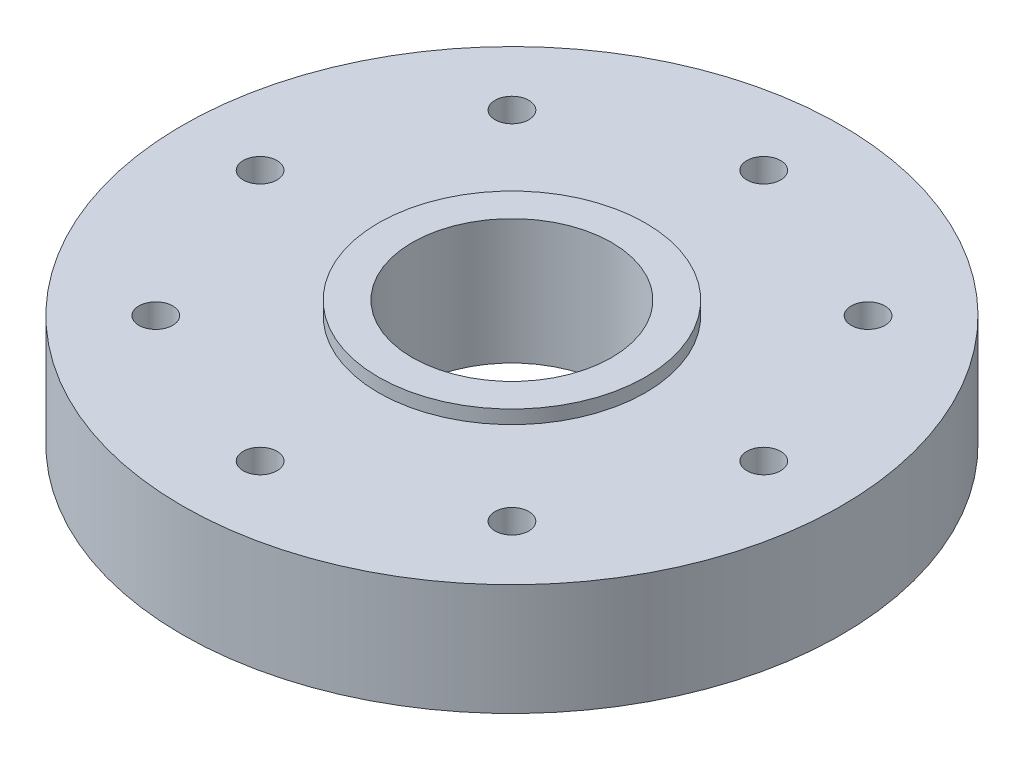
from build123d import *

# Parameters (mm, degrees)
SKETCH1_R           = 9.75
SKETCH1_R_2         = 2.95
SKETCH1_R_3         = 0.5
BOSS_EXTRUDE1_DEPTH = 3.3
SKETCH2_R           = 3.95
SKETCH2_R_2         = 2.95
BOSS_EXTRUDE2_DEPTH = 0.4


with BuildPart() as part:
    # Sketch1 → Boss-Extrude1 (new body)
    with BuildSketch(Plane(origin=(0, 0, 0), x_dir=(1, 0, 0), z_dir=(0, 1, 0))):
        with Locations(Location((0, 0, 0), (0, 0, 270))):
            Circle(SKETCH1_R)
        with Locations(Location((0, 0, 0), (0, 0, 270))):
            Circle(SKETCH1_R_2, mode=Mode.SUBTRACT)
        with Locations(Location((0, 7.45, 0), (0, 0, 270))):
            Circle(SKETCH1_R_3, mode=Mode.SUBTRACT)
        with Locations(Location((5.26794552, 5.26794552, 0), (0, 0, 270))):
            Circle(SKETCH1_R_3, mode=Mode.SUBTRACT)
        with Locations(Location((7.45, 0, 0), (0, 0, 270))):
            Circle(SKETCH1_R_3, mode=Mode.SUBTRACT)
        with Locations(Location((5.26794552, -5.26794552, 0), (0, 0, 270))):
            Circle(SKETCH1_R_3, mode=Mode.SUBTRACT)
        with Locations(Location((0, -7.45, 0), (0, 0, 270))):
            Circle(SKETCH1_R_3, mode=Mode.SUBTRACT)
        with Locations(Location((-5.26794552, -5.26794552, 0), (0, 0, 270))):
            Circle(SKETCH1_R_3, mode=Mode.SUBTRACT)
        with Locations(Location((-7.45, 0, 0), (0, 0, 270))):
            Circle(SKETCH1_R_3, mode=Mode.SUBTRACT)
        with Locations(Location((-5.26794552, 5.26794552, 0), (0, 0, 270))):
            Circle(SKETCH1_R_3, mode=Mode.SUBTRACT)
    extrude(amount=BOSS_EXTRUDE1_DEPTH)

    # Sketch2 → Boss-Extrude2 (add)
    with BuildSketch(Plane(origin=(0, 3.3, 0), x_dir=(1, 0, 0), z_dir=(0, 1, 0))):
        with Locations(Location((0, 0, 0), (0, 0, 270))):
            Circle(SKETCH2_R)
        with Locations(Location((0, 0, 0), (0, 0, 270))):
            Circle(SKETCH2_R_2, mode=Mode.SUBTRACT)
    extrude(amount=BOSS_EXTRUDE2_DEPTH)


solid = part.part
